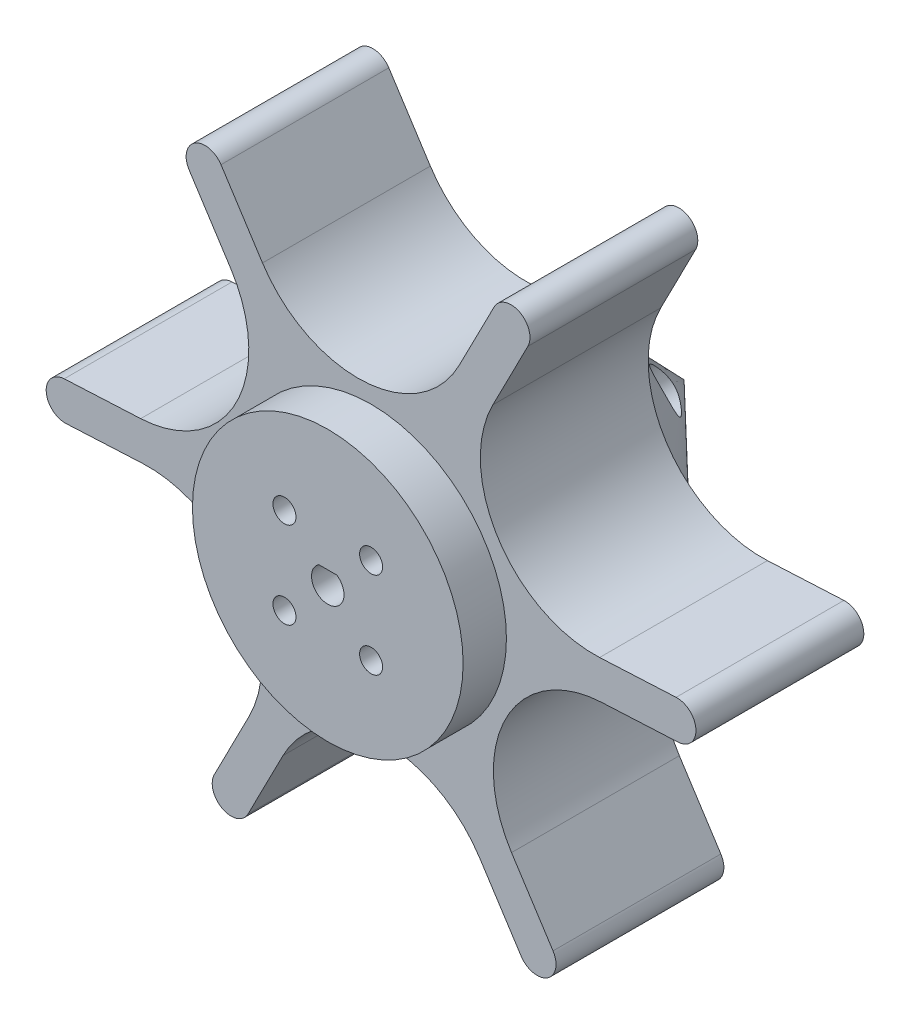
from build123d import *

# Parameters (mm, degrees)
SKETCH1_R                      = 3.5
BOSS_EXTRUDE1_DEPTH            = 21
SKETCH4_R                      = 25
BOSS_EXTRUDE2_DEPTH            = 18
CUT_EXTRUDE2_DEPTH             = 20
SKETCH7_R                      = 2.125
CUT_EXTRUDE3_DEPTH             = 105.070425208
SKETCH9_R                      = 4
CUT_EXTRUDE4_DEPTH             = 36
CUT_EXTRUDE4_DIRECTION_2_REACH = 91.556
SKETCH10_R                     = 2.125
BOSS_EXTRUDE3_DEPTH            = 10


with BuildPart() as part:
    # Sketch1 → Boss-Extrude1 (new body)
    with BuildSketch(Plane.XY):
        with BuildLine():
            ThreePointArc((-27.16441994, 47.550254291), (-29.67571676, 44.192804958), (-33.605829095, 45.653385243))
            Line((-33.605829095, 45.653385243), (-25.93972411, 33.765821671))
            ThreePointArc((-25.93972411, 33.765821671), (-24.90753088, 12.791204222), (-42.555985811, 1.409989939))
            Line((-42.555985811, 1.409989939), (-56.683970347, 0.71473006))
            ThreePointArc((-56.683970347, 0.71473006), (-54.098653318, -0.246072778), (-53.011938142, -2.781039515))
            ThreePointArc((-53.011938142, -2.781039515), (-53.976971405, -5.194324339), (-56.339905937, -6.27680909))
            Line((-56.339905937, -6.27680909), (-42.211921401, -5.581549211))
            ThreePointArc((-42.211921401, -5.581549211), (-23.531273241, -15.174952377), (-22.499080012, -36.149569826))
            Line((-22.499080012, -36.149569826), (-28.960959562, -48.732393278))
            ThreePointArc((-28.960959562, -48.732393278), (-25.025035607, -46.929305801), (-22.347518202, -50.331293805))
            ThreePointArc((-22.347518202, -50.331293805), (-22.445530198, -51.153776401), (-22.734076842, -51.930194333))
            Line((-22.734076842, -51.930194333), (-16.272197292, -39.347370882))
            ThreePointArc((-16.272197292, -39.347370882), (1.376257639, -27.966156599), (20.0569058, -37.559559765))
            Line((20.0569058, -37.559559765), (27.723010785, -49.447123338))
            ThreePointArc((27.723010785, -49.447123338), (28.767550893, -44.608845135), (33.605829095, -45.653385243))
            Line((33.605829095, -45.653385243), (25.93972411, -33.765821671))
            ThreePointArc((25.93972411, -33.765821671), (24.90753088, -12.791204222), (42.555985811, -1.409989939))
            Line((42.555985811, -1.409989939), (56.683970347, -0.71473006))
            ThreePointArc((56.683970347, -0.71473006), (53.016168567, 2.60900731), (56.339905937, 6.27680909))
            Line((56.339905937, 6.27680909), (42.211921401, 5.581549211))
            ThreePointArc((42.211921401, 5.581549211), (23.531273241, 15.174952377), (22.499080012, 36.149569826))
            Line((22.499080012, 36.149569826), (28.960959562, 48.732393278))
            ThreePointArc((28.960959562, 48.732393278), (24.248617674, 47.217852445), (22.734076842, 51.930194333))
            Line((22.734076842, 51.930194333), (16.272197292, 39.347370882))
            ThreePointArc((16.272197292, 39.347370882), (-1.376257639, 27.966156599), (-20.0569058, 37.559559765))
            Line((-20.0569058, 37.559559765), (-27.723010785, 49.447123338))
            ThreePointArc((-27.723010785, 49.447123338), (-27.306970607, 48.538957471), (-27.16441994, 47.550254291))
        make_face()
        with Locations((-56.511938142, -2.781039515)):
            Circle(SKETCH1_R)
        with Locations((-30.66441994, 47.550254291)):
            Circle(SKETCH1_R)
        with Locations((25.847518202, 50.331293805)):
            Circle(SKETCH1_R)
        with Locations((56.511938142, 2.781039515)):
            Circle(SKETCH1_R)
        with Locations((30.66441994, -47.550254291)):
            Circle(SKETCH1_R)
        with Locations((-25.847518202, -50.331293805)):
            Circle(SKETCH1_R)
    extrude(amount=BOSS_EXTRUDE1_DEPTH)

    # Sketch3 → Revolve1 (revolve)
    with BuildSketch(Plane(origin=(0, 0, 0), x_dir=(-0.9987913071010414, -0.04915205854685543, 0), z_dir=(0.04915205854685543, -0.9987913071010414, 0)), mode=Mode.PRIVATE) as revolve1_sk:
        Polygon((0, 0), (-28, 0), (0, 26.813467396), align=None)
    revolve(revolve1_sk.sketch.rotate(Axis((0, 0, -26.813467396), (0, 0, 1)), 357.182659299), axis=Axis((0, 0, -26.813467396), (0, 0, 1)))

    # Sketch4 → Boss-Extrude2 (add)
    with BuildSketch(Plane.XY.offset(21)):
        Circle(SKETCH4_R)
    extrude(amount=BOSS_EXTRUDE2_DEPTH)

    # Sketch5 → Cut-Extrude2 (cut)
    with BuildSketch(Plane.XY.offset(39)):
        with BuildLine():
            Line((-1.658312395, 2.5), (1.658312395, 2.5))
            ThreePointArc((1.658312395, 2.5), (0, -3), (-1.658312395, 2.5))
        make_face()
    extrude(amount=-CUT_EXTRUDE2_DEPTH, mode=Mode.SUBTRACT)

    # Sketch7 → Cut-Extrude3 (cut, through all)
    with BuildSketch(Plane.XY.offset(39)):
        with Locations((-8, 8)):
            Circle(SKETCH7_R)
        with Locations(Location((8, 8, 0), (0, 0, 225))):
            Circle(SKETCH7_R)
        with Locations((8, -8)):
            Circle(SKETCH7_R)
        with Locations(Location((-8, -8, 0), (0, 0, 110.081495148))):
            Circle(SKETCH7_R)
    extrude(amount=-CUT_EXTRUDE3_DEPTH, mode=Mode.SUBTRACT)

    # Sketch9 → Cut-Extrude4 (cut)
    with BuildSketch(Plane(origin=(0, 0, 0), x_dir=(-1, 0, 0), z_dir=(0, 0, -1))):
        with Locations(Location((-8, 8, 0), (0, 0, 315))):
            Circle(SKETCH9_R)
        with Locations(Location((8, 8, 0), (0, 0, 225))):
            Circle(SKETCH9_R)
        with Locations(Location((8, -8, 0), (0, 0, 135))):
            Circle(SKETCH9_R)
        with Locations(Location((-8, -8, 0), (0, 0, 45))):
            Circle(SKETCH9_R)
    extrude(amount=-CUT_EXTRUDE4_DEPTH, mode=Mode.SUBTRACT)

    # Cut-Extrude4 direction 2: up to this cone (the profile starts inside it)
    cut_extrude4_direction_2_end = Plane(origin=(0, 0, 0), z_dir=(0, 0, 1)).offset(-26.813466396) * Cone(1.044e-06, 153.368642194, 146.869466396, align=(Align.CENTER, Align.CENTER, Align.MIN), mode=Mode.PRIVATE)
    # Sketch9 → Cut-Extrude4 direction 2 (cut, up to the surface)
    with BuildSketch(Plane(origin=(0, 0, 0), x_dir=(-1, 0, 0), z_dir=(0, 0, -1)), mode=Mode.PRIVATE) as cut_extrude4_direction_2_sk1:
        with Locations(Location((-8, 8, 0), (0, 0, 315))):
            Circle(SKETCH9_R)
    cut_extrude4_direction_2_tool1 = extrude(cut_extrude4_direction_2_sk1.sketch, amount=CUT_EXTRUDE4_DIRECTION_2_REACH, mode=Mode.PRIVATE) & cut_extrude4_direction_2_end
    add(cut_extrude4_direction_2_tool1.solids().sort_by_distance((8, 8, 0))[0], mode=Mode.SUBTRACT)
    # Sketch9 → Cut-Extrude4 direction 2 (cut, up to the surface)
    with BuildSketch(Plane(origin=(0, 0, 0), x_dir=(-1, 0, 0), z_dir=(0, 0, -1)), mode=Mode.PRIVATE) as cut_extrude4_direction_2_sk2:
        with Locations(Location((8, 8, 0), (0, 0, 225))):
            Circle(SKETCH9_R)
    cut_extrude4_direction_2_tool2 = extrude(cut_extrude4_direction_2_sk2.sketch, amount=CUT_EXTRUDE4_DIRECTION_2_REACH, mode=Mode.PRIVATE) & cut_extrude4_direction_2_end
    add(cut_extrude4_direction_2_tool2.solids().sort_by_distance((-8, 8, 0))[0], mode=Mode.SUBTRACT)
    # Sketch9 → Cut-Extrude4 direction 2 (cut, up to the surface)
    with BuildSketch(Plane(origin=(0, 0, 0), x_dir=(-1, 0, 0), z_dir=(0, 0, -1)), mode=Mode.PRIVATE) as cut_extrude4_direction_2_sk3:
        with Locations(Location((8, -8, 0), (0, 0, 135))):
            Circle(SKETCH9_R)
    cut_extrude4_direction_2_tool3 = extrude(cut_extrude4_direction_2_sk3.sketch, amount=CUT_EXTRUDE4_DIRECTION_2_REACH, mode=Mode.PRIVATE) & cut_extrude4_direction_2_end
    add(cut_extrude4_direction_2_tool3.solids().sort_by_distance((-8, -8, 0))[0], mode=Mode.SUBTRACT)
    # Sketch9 → Cut-Extrude4 direction 2 (cut, up to the surface)
    with BuildSketch(Plane(origin=(0, 0, 0), x_dir=(-1, 0, 0), z_dir=(0, 0, -1)), mode=Mode.PRIVATE) as cut_extrude4_direction_2_sk4:
        with Locations(Location((-8, -8, 0), (0, 0, 45))):
            Circle(SKETCH9_R)
    cut_extrude4_direction_2_tool4 = extrude(cut_extrude4_direction_2_sk4.sketch, amount=CUT_EXTRUDE4_DIRECTION_2_REACH, mode=Mode.PRIVATE) & cut_extrude4_direction_2_end
    add(cut_extrude4_direction_2_tool4.solids().sort_by_distance((8, -8, 0))[0], mode=Mode.SUBTRACT)

    # Sketch10 → Boss-Extrude3 (add)
    with BuildSketch(Plane.XY.offset(21)):
        with BuildLine():
            Line((-22.499080012, -36.149569826), (-28.960959562, -48.732393278))
            ThreePointArc((-28.960959562, -48.732393278), (-27.44641873, -53.444735165), (-22.734076842, -51.930194333))
            Line((-22.734076842, -51.930194333), (-16.272197292, -39.347370882))
            ThreePointArc((-16.272197292, -39.347370882), (1.376257639, -27.966156599), (20.0569058, -37.559559765))
            Line((20.0569058, -37.559559765), (27.723010785, -49.447123338))
            ThreePointArc((27.723010785, -49.447123338), (32.561288987, -50.491663446), (33.605829095, -45.653385243))
            Line((33.605829095, -45.653385243), (25.93972411, -33.765821671))
            ThreePointArc((25.93972411, -33.765821671), (24.90753088, -12.791204222), (42.555985811, -1.409989939))
            Line((42.555985811, -1.409989939), (56.683970347, -0.71473006))
            ThreePointArc((56.683970347, -0.71473006), (60.007707717, 2.95307172), (56.339905937, 6.27680909))
            Line((56.339905937, 6.27680909), (42.211921401, 5.581549211))
            ThreePointArc((42.211921401, 5.581549211), (23.531273241, 15.174952377), (22.499080012, 36.149569826))
            Line((22.499080012, 36.149569826), (28.960959562, 48.732393278))
            ThreePointArc((28.960959562, 48.732393278), (27.44641873, 53.444735165), (22.734076842, 51.930194333))
            Line((22.734076842, 51.930194333), (16.272197292, 39.347370882))
            ThreePointArc((16.272197292, 39.347370882), (-1.376257639, 27.966156599), (-20.0569058, 37.559559765))
            Line((-20.0569058, 37.559559765), (-27.723010785, 49.447123338))
            ThreePointArc((-27.723010785, 49.447123338), (-32.561288987, 50.491663446), (-33.605829095, 45.653385243))
            Line((-33.605829095, 45.653385243), (-25.93972411, 33.765821671))
            ThreePointArc((-25.93972411, 33.765821671), (-24.90753088, 12.791204222), (-42.555985811, 1.409989939))
            Line((-42.555985811, 1.409989939), (-56.683970347, 0.71473006))
            ThreePointArc((-56.683970347, 0.71473006), (-60.007707717, -2.95307172), (-56.339905937, -6.27680909))
            Line((-56.339905937, -6.27680909), (-42.211921401, -5.581549211))
            ThreePointArc((-42.211921401, -5.581549211), (-23.531273241, -15.174952377), (-22.499080012, -36.149569826))
        make_face()
        with Locations((8, -8)):
            Circle(SKETCH10_R, mode=Mode.SUBTRACT)
        with Locations((-8, -8)):
            Circle(SKETCH10_R, mode=Mode.SUBTRACT)
        with Locations((8, 8)):
            Circle(SKETCH10_R, mode=Mode.SUBTRACT)
        with Locations((-8, 8)):
            Circle(SKETCH10_R, mode=Mode.SUBTRACT)
        with BuildLine():
            Line((-1.658312395, 2.5), (1.658312395, 2.5))
            ThreePointArc((1.658312395, 2.5), (0, -3), (-1.658312395, 2.5))
        make_face(mode=Mode.SUBTRACT)
    extrude(amount=BOSS_EXTRUDE3_DEPTH)


solid = part.part
